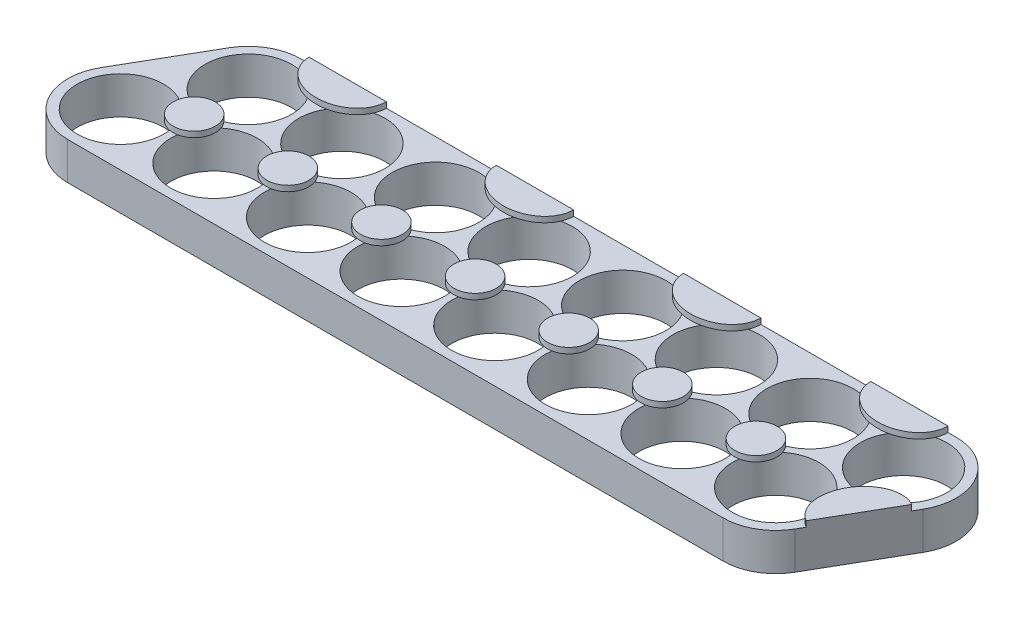
from build123d import *

# Parameters (mm, degrees)
SKETCH2_R           = 9.25
BOSS_EXTRUDE1_DEPTH = 4
SKETCH3_R           = 4.5
BOSS_EXTRUDE2_DEPTH = 1.2


with BuildPart() as part:
    # Sketch2 → Boss-Extrude1 (new, symmetric)
    with BuildSketch(Plane(origin=(0, 0, 0), x_dir=(1, 0, 0), z_dir=(0, 1, 0))):
        with BuildLine():
            Line((0.257214207, 22.945508076), (-9.742785793, 5.625))
            ThreePointArc((-9.742785793, 5.625), (-9.742785793, -5.625), (0, -11.25))
            Line((0, -11.25), (140, -11.25))
            ThreePointArc((140, -11.25), (145.625, -9.742785793), (149.742785793, -5.625))
            Line((149.742785793, -5.625), (159.742785793, 11.695508076))
            ThreePointArc((159.742785793, 11.695508076), (159.742785793, 22.945508076), (150, 28.570508076))
            Line((150, 28.570508076), (10, 28.570508076))
            ThreePointArc((10, 28.570508076), (4.375, 27.063293868), (0.257214207, 22.945508076))
        make_face()
        with Locations(Location((10, 17.320508076, 0), (0, 0, 270))):
            Circle(SKETCH2_R, mode=Mode.SUBTRACT)
        with Locations(Location((0, 0, 0), (0, 0, 270))):
            Circle(SKETCH2_R, mode=Mode.SUBTRACT)
        with Locations(Location((20, 0, 0), (0, 0, 270))):
            Circle(SKETCH2_R, mode=Mode.SUBTRACT)
        with Locations(Location((40, 0, 0), (0, 0, 270))):
            Circle(SKETCH2_R, mode=Mode.SUBTRACT)
        with Locations(Location((60, 0, 0), (0, 0, 270))):
            Circle(SKETCH2_R, mode=Mode.SUBTRACT)
        with Locations(Location((80, 0, 0), (0, 0, 270))):
            Circle(SKETCH2_R, mode=Mode.SUBTRACT)
        with Locations(Location((100, 0, 0), (0, 0, 270))):
            Circle(SKETCH2_R, mode=Mode.SUBTRACT)
        with Locations(Location((120, 0, 0), (0, 0, 270))):
            Circle(SKETCH2_R, mode=Mode.SUBTRACT)
        with Locations(Location((140, 0, 0), (0, 0, 270))):
            Circle(SKETCH2_R, mode=Mode.SUBTRACT)
        with Locations(Location((30, 17.320508076, 0), (0, 0, 270))):
            Circle(SKETCH2_R, mode=Mode.SUBTRACT)
        with Locations(Location((50, 17.320508076, 0), (0, 0, 270))):
            Circle(SKETCH2_R, mode=Mode.SUBTRACT)
        with Locations(Location((70, 17.320508076, 0), (0, 0, 270))):
            Circle(SKETCH2_R, mode=Mode.SUBTRACT)
        with Locations(Location((90, 17.320508076, 0), (0, 0, 270))):
            Circle(SKETCH2_R, mode=Mode.SUBTRACT)
        with Locations(Location((110, 17.320508076, 0), (0, 0, 270))):
            Circle(SKETCH2_R, mode=Mode.SUBTRACT)
        with Locations(Location((130, 17.320508076, 0), (0, 0, 270))):
            Circle(SKETCH2_R, mode=Mode.SUBTRACT)
        with Locations(Location((150, 17.320508076, 0), (0, 0, 270))):
            Circle(SKETCH2_R, mode=Mode.SUBTRACT)
    extrude(amount=BOSS_EXTRUDE1_DEPTH, both=True)

    # Sketch3 → Boss-Extrude2 (add)
    with BuildSketch(Plane(origin=(0, 4, 0), x_dir=(1, 0, 0), z_dir=(0, 1, 0))):
        with Locations(Location((10, 5.773502692, 0), (0, 0, 139.11591968))):
            Circle(SKETCH3_R)
        with Locations(Location((30, 5.773502692, 0), (0, 0, 40.88408032))):
            Circle(SKETCH3_R)
        with Locations(Location((50, 5.773502692, 0), (0, 0, 40.88408032))):
            Circle(SKETCH3_R)
        with Locations(Location((70, 5.773502692, 0), (0, 0, 40.88408032))):
            Circle(SKETCH3_R)
        with Locations(Location((90, 5.773502692, 0), (0, 0, 40.88408032))):
            Circle(SKETCH3_R)
        with Locations(Location((110, 5.773502692, 0), (0, 0, 40.88408032))):
            Circle(SKETCH3_R)
        with Locations(Location((130, 5.773502692, 0), (0, 0, 40.88408032))):
            Circle(SKETCH3_R)
        with BuildLine():
            Line((28.25, 28.570508076), (11.75, 28.570508076))
            add(Edge.make_bspline(
                [(11.75, 28.570508076), (11.75, 21.820508076), (20, 21.820508076), (28.25, 21.820508076), (28.25, 28.570508076)],
                knots=[3.141592654, 3.141592654, 3.141592654, 4.71238898, 4.71238898, 6.283185307, 6.283185307, 6.283185307], degree=2, weights=[1, 0.707106781, 1, 0.707106781, 1]))
        make_face()
        with BuildLine():
            Line((68.25, 28.570508076), (51.75, 28.570508076))
            add(Edge.make_bspline(
                [(51.75, 28.570508076), (51.75, 21.820508076), (60, 21.820508076), (68.25, 21.820508076), (68.25, 28.570508076)],
                knots=[3.141592654, 3.141592654, 3.141592654, 4.71238898, 4.71238898, 6.283185307, 6.283185307, 6.283185307], degree=2, weights=[1, 0.707106781, 1, 0.707106781, 1]))
        make_face()
        with BuildLine():
            Line((108.25, 28.570508076), (91.75, 28.570508076))
            add(Edge.make_bspline(
                [(91.75, 28.570508076), (91.75, 21.820508076), (100, 21.820508076), (108.25, 21.820508076), (108.25, 28.570508076)],
                knots=[3.141592654, 3.141592654, 3.141592654, 4.71238898, 4.71238898, 6.283185307, 6.283185307, 6.283185307], degree=2, weights=[1, 0.707106781, 1, 0.707106781, 1]))
        make_face()
        with BuildLine():
            Line((148.25, 28.570508076), (131.75, 28.570508076))
            add(Edge.make_bspline(
                [(131.75, 28.570508076), (131.75, 21.820508076), (140, 21.820508076), (148.25, 21.820508076), (148.25, 28.570508076)],
                knots=[3.141592654, 3.141592654, 3.141592654, 4.71238898, 4.71238898, 6.283185307, 6.283185307, 6.283185307], degree=2, weights=[1, 0.707106781, 1, 0.707106781, 1]))
        make_face()
        with BuildLine():
            Line((158.867785793, 10.179963619), (150.617785793, -4.109455543))
            add(Edge.make_bspline(
                [(158.867785793, 10.179963619), (153.022114317, 13.554963619), (148.897114317, 6.410254038), (144.772114317, -0.734455543), (150.617785793, -4.109455543)],
                knots=[0, 0, 0, 1.570796327, 1.570796327, 3.141592654, 3.141592654, 3.141592654], degree=2, weights=[1, 0.707106781, 1, 0.707106781, 1]))
        make_face()
    extrude(amount=BOSS_EXTRUDE2_DEPTH)


solid = part.part
